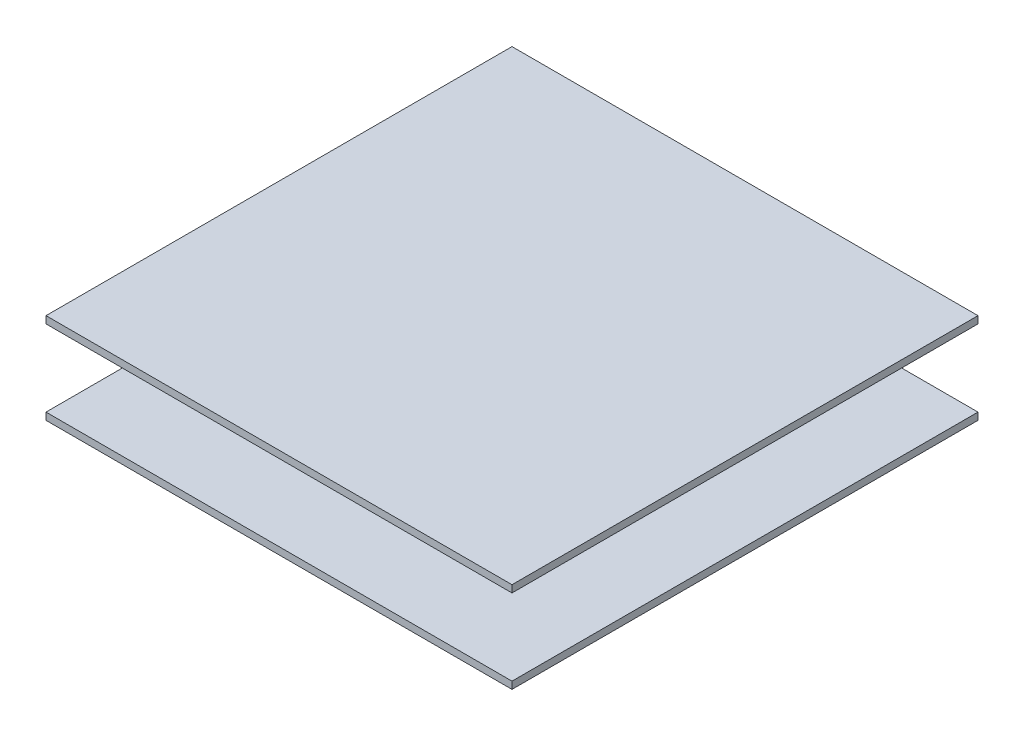
from build123d import *

# Parameters (mm, degrees)
SKETCH1_W           = 12.7
SKETCH1_H           = 12.7
BOSS_EXTRUDE1_DEPTH = 80
SKETCH2_R           = 2
CUT_EXTRUDE1_DEPTH  = 82.991341006
CUT_EXTRUDE2_DEPTH  = 82.991341006
BOSS_EXTRUDE2_START = 17
SKETCH5_R           = 2
BOSS_EXTRUDE2_DEPTH = 17
SKETCH6_R           = 2
BOSS_EXTRUDE3_DEPTH = 17
SKETCH7_W           = 130
SKETCH7_H           = 130
BOSS_EXTRUDE4_DEPTH = 2
SKETCH8_W           = 130
SKETCH8_H           = 130
BOSS_EXTRUDE5_DEPTH = 2


with BuildPart() as part:
    # Sketch1 → Boss-Extrude1 (new body)
    with BuildSketch(Plane.XY):
        with Locations((6.35, 6.35)):
            Rectangle(SKETCH1_W, SKETCH1_H)
    extrude(amount=BOSS_EXTRUDE1_DEPTH)

    # Sketch2 → Cut-Extrude1 (cut, through all)
    with BuildSketch(Plane(origin=(0, 12.7, 0), x_dir=(1, 0, 0), z_dir=(0, 1, 0))):
        with Locations(Location((6.668720536, -5, 0), (0, 0, 270))):
            Circle(SKETCH2_R)
        with Locations(Location((6.668720536, -20, 0), (0, 0, 270))):
            Circle(SKETCH2_R)
        with Locations(Location((6.668720536, -60, 0), (0, 0, 270))):
            Circle(SKETCH2_R)
        with Locations(Location((6.668720536, -75, 0), (0, 0, 270))):
            Circle(SKETCH2_R)
    extrude(amount=-CUT_EXTRUDE1_DEPTH, mode=Mode.SUBTRACT)

    # Sketch4 → Cut-Extrude2 (cut, through all)
    with BuildSketch(Plane.ZY):
        with BuildLine():
            ThreePointArc((40, 2.727500863), (49.05, 6.35), (40, 9.972499137))
            ThreePointArc((40, 9.972499137), (30.95, 6.35), (40, 2.727500863))
        make_face()
    extrude(amount=-CUT_EXTRUDE2_DEPTH, mode=Mode.SUBTRACT)

    # Sketch5 → Boss-Extrude2 (add)
    with BuildSketch(Plane(origin=(0, 0, 0), x_dir=(1, 0, 0), z_dir=(0, 1, 0)).offset(BOSS_EXTRUDE2_START)):
        with Locations(Location((6.668720536, -20, 0), (0, 0, 270))):
            Circle(SKETCH5_R)
        with Locations(Location((6.668720536, -5, 0), (0, 0, 270))):
            Circle(SKETCH5_R)
    extrude(amount=-BOSS_EXTRUDE2_DEPTH)

    # Sketch6 → Boss-Extrude3 (add)
    with BuildSketch(Plane(origin=(0, 12.7, 0), x_dir=(1, 0, 0), z_dir=(0, 1, 0))):
        with Locations(Location((6.668720536, -75, 0), (0, 0, 270))):
            Circle(SKETCH6_R)
        with Locations(Location((6.668720536, -60, 0), (0, 0, 270))):
            Circle(SKETCH6_R)
    extrude(amount=-BOSS_EXTRUDE3_DEPTH)

    # Sketch7 → Boss-Extrude4 (add)
    with BuildSketch(Plane(origin=(0, 17, 0), x_dir=(1, 0, 0), z_dir=(0, 1, 0))):
        with Locations((6.35, -40)):
            Rectangle(SKETCH7_W, SKETCH7_H)
    extrude(amount=BOSS_EXTRUDE4_DEPTH)

    # Sketch8 → Boss-Extrude5 (add)
    with BuildSketch(Plane.XZ.offset(4.3)):
        with Locations((6.35, 40)):
            Rectangle(SKETCH8_W, SKETCH8_H)
    extrude(amount=BOSS_EXTRUDE5_DEPTH)


solid = part.part
